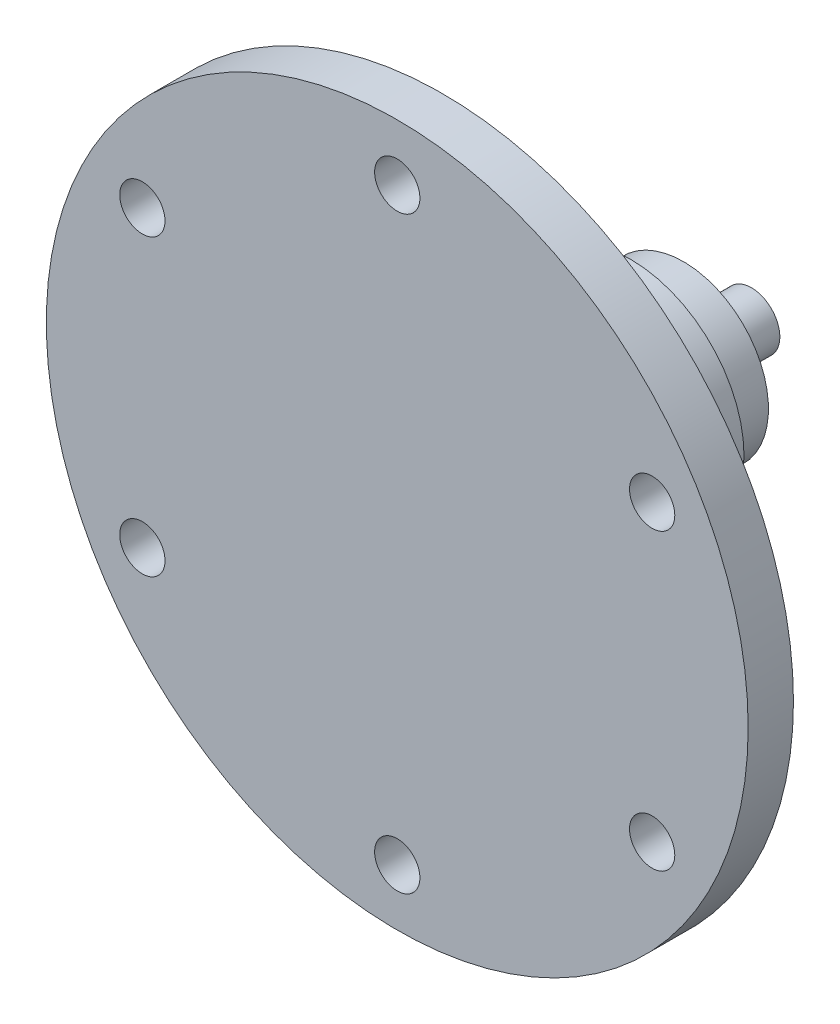
from build123d import *

# Parameters (mm, degrees)
SKETCH1_R           = 31
SKETCH1_R_2         = 2
BOSS_EXTRUDE1_DEPTH = 4
SKETCH2_R           = 22.5
BOSS_EXTRUDE2_DEPTH = 4.63
SKETCH3_R           = 10
BOSS_EXTRUDE3_DEPTH = 12
SKETCH4_R           = 7.5
BOSS_EXTRUDE4_DEPTH = 4.66
SKETCH7_R           = 2.505
BOSS_EXTRUDE5_DEPTH = 6


with BuildPart() as part:
    # Sketch1 → Boss-Extrude1 (new body)
    with BuildSketch(Plane.XY):
        Circle(SKETCH1_R)
        with Locations((0, 26)):
            Circle(SKETCH1_R_2, mode=Mode.SUBTRACT)
        with Locations((22.516660498, 13)):
            Circle(SKETCH1_R_2, mode=Mode.SUBTRACT)
        with Locations((22.516660498, -13)):
            Circle(SKETCH1_R_2, mode=Mode.SUBTRACT)
        with Locations((0, -26)):
            Circle(SKETCH1_R_2, mode=Mode.SUBTRACT)
        with Locations((-22.516660498, -13)):
            Circle(SKETCH1_R_2, mode=Mode.SUBTRACT)
        with Locations((-22.516660498, 13)):
            Circle(SKETCH1_R_2, mode=Mode.SUBTRACT)
    extrude(amount=BOSS_EXTRUDE1_DEPTH)

    # Sketch2 → Boss-Extrude2 (add)
    with BuildSketch(Plane(origin=(0, 0, 0), x_dir=(-1, 0, 0), z_dir=(0, 0, -1))):
        with Locations(Location((0, 0, 0), (0, 0, 180))):
            Circle(SKETCH2_R)
    extrude(amount=BOSS_EXTRUDE2_DEPTH)

    # Sketch3 → Boss-Extrude3 (add)
    with BuildSketch(Plane(origin=(0, 0, -4.63), x_dir=(-1, 0, 0), z_dir=(0, 0, -1))):
        Circle(SKETCH3_R)
    extrude(amount=BOSS_EXTRUDE3_DEPTH)

    # Sketch4 → Boss-Extrude4 (add)
    with BuildSketch(Plane(origin=(0, 0, -16.63), x_dir=(-1, 0, 0), z_dir=(0, 0, -1))):
        Circle(SKETCH4_R)
    extrude(amount=BOSS_EXTRUDE4_DEPTH)

    # Sketch7 → Boss-Extrude5 (add)
    with BuildSketch(Plane(origin=(0, 0, -21.29), x_dir=(-1, 0, 0), z_dir=(0, 0, -1))):
        Circle(SKETCH7_R)
    extrude(amount=BOSS_EXTRUDE5_DEPTH)


solid = part.part
